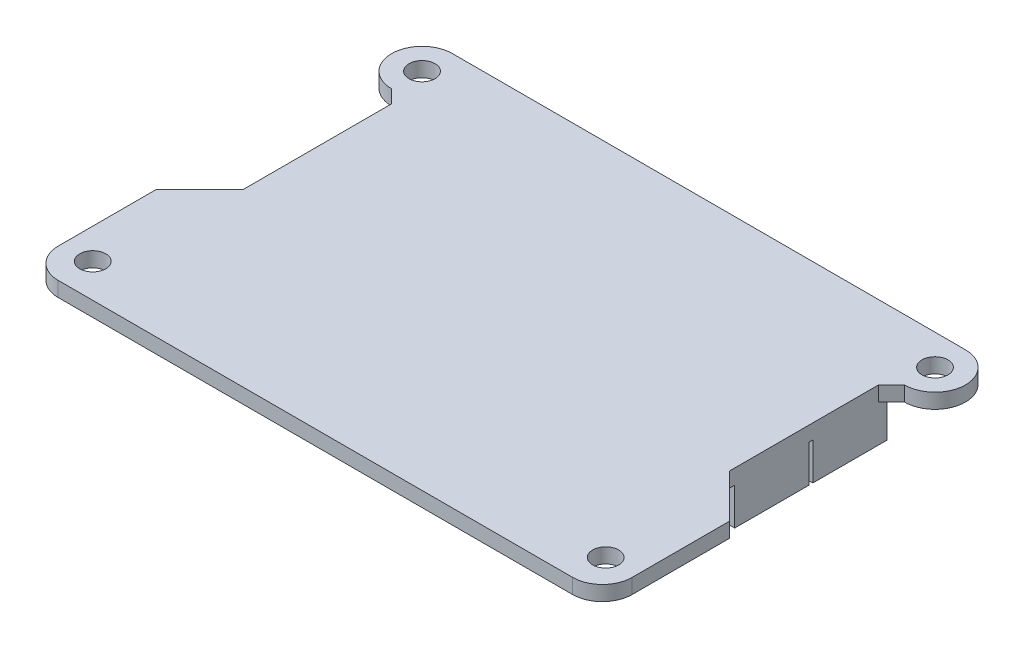
from build123d import *

# Parameters (mm, degrees)
SKETCH_1_R          = 1.75
EXTRUDE_1_DEPTH     = 2
FILLET_1_R          = 4
SKETCH_2_W          = 5
SKETCH_2_H          = 10
EXTRUDE_2_DEPTH     = 5
CUT_EXTRUDE_1_DEPTH = 0.2
SKETCH_5_W          = 18.176567436
SKETCH_5_H          = 8.683574631
EXTRUDE_3_DEPTH     = 5


with BuildPart() as part:
    # 草图1 → 凸台-拉伸1 (new body)
    with BuildSketch(Plane(origin=(0, 0, 0), x_dir=(1, 0, 0), z_dir=(0, 1, 0))):
        with BuildLine():
            Line((-34.475, 43.140944253), (34.475, 43.140944253))
            ThreePointArc((34.475, 43.140944253), (38.57, 39.045944253), (34.475, 34.950944253))
            Line((34.475, 34.950944253), (32.725, 33.200944253))
            Line((32.725, 33.200944253), (32.725, 13.200944253))
            Line((32.725, 13.200944253), (38.57, 7.355944253))
            Line((38.57, 7.355944253), (38.57, -9.759055747))
            Line((38.57, -9.759055747), (-38.57, -9.759055747))
            Line((-38.57, -9.759055747), (-38.57, 7.355944253))
            Line((-38.57, 7.355944253), (-32.725, 13.200944253))
            Line((-32.725, 13.200944253), (-32.725, 33.200944253))
            Line((-32.725, 33.200944253), (-34.475, 34.950944253))
            ThreePointArc((-34.475, 34.950944253), (-38.57, 39.045944253), (-34.475, 43.140944253))
        make_face()
        with Locations(Location((34.475, 39.045944253, 0), (0, 0, 270))):
            Circle(SKETCH_1_R, mode=Mode.SUBTRACT)
        with Locations(Location((34.475, -5.214055747, 0), (0, 0, 270))):
            Circle(SKETCH_1_R, mode=Mode.SUBTRACT)
        with Locations(Location((-34.475, -5.214055747, 0), (0, 0, 90))):
            Circle(SKETCH_1_R, mode=Mode.SUBTRACT)
        with Locations(Location((-34.475, 39.045944253, 0), (0, 0, 90))):
            Circle(SKETCH_1_R, mode=Mode.SUBTRACT)
    extrude(amount=EXTRUDE_1_DEPTH)

    # 圆角1
    fillet_1_edges = [part.edges().sort_by_distance(p)[0] for p in [
        (38.57, 1, 9.759055747),
        (-38.57, 1, 9.759055747),
    ]]
    fillet(fillet_1_edges, radius=FILLET_1_R)

    # 草图2 → 凸台-拉伸2 (add)
    with BuildSketch(Plane.XZ):
        with Locations((30.225, -29.368896619)):
            Rectangle(SKETCH_2_W, SKETCH_2_H)
        with Locations((-30.225, -27.845518443)):
            Rectangle(SKETCH_2_W, SKETCH_2_H)
        with Locations((30.225, -18.877356426)):
            Rectangle(SKETCH_2_W, SKETCH_2_H)
    extrude(amount=EXTRUDE_2_DEPTH)

    # 草图4 → 切除-拉伸1 (cut)
    with BuildSketch(Plane.XZ.offset(5)):
        Polygon((31.631043608, -19.986230369), (31.631043608, -17.932277654), (31.131043608, -17.932277654), (31.131043608, -18.656291548), (29.131043608, -18.656291548), (29.131043608, -17.932277654), (28.631043608, -17.932277654), (28.631043608, -19.986230369), (29.131043608, -19.986230369), (29.131043608, -19.151981589), (31.131043608, -19.151981589), (31.131043608, -19.986230369), align=None)
    extrude(amount=-CUT_EXTRUDE_1_DEPTH, mode=Mode.SUBTRACT)

    # 草图5 → 凸台-拉伸3 (add)
    with BuildSketch(Plane.XZ):
        with Locations((-22.049742487, -1.912133925)):
            Rectangle(SKETCH_5_W, SKETCH_5_H)
    extrude(amount=EXTRUDE_3_DEPTH)


solid = part.part
